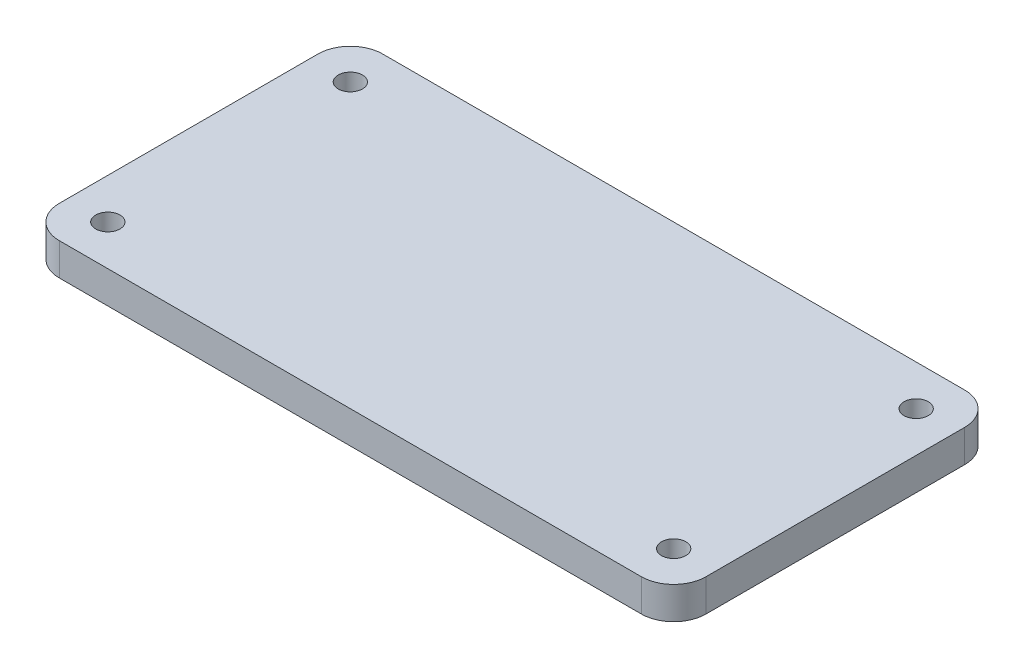
from build123d import *

# Parameters (mm, degrees)
SKETCH1_W           = 80
SKETCH1_H           = 40
SKETCH1_R           = 1.5
BOSS_EXTRUDE1_DEPTH = 4
FILLET1_R           = 4


with BuildPart() as part:
    # Sketch1 → Boss-Extrude1 (new body)
    with BuildSketch(Plane(origin=(0, 0, 0), x_dir=(1, 0, 0), z_dir=(0, 1, 0))):
        Rectangle(SKETCH1_W, SKETCH1_H)
        with Locations(Location((-35, 15, 0), (0, 0, 270))):
            Circle(SKETCH1_R, mode=Mode.SUBTRACT)
        with Locations(Location((35, 15, 0), (0, 0, 90))):
            Circle(SKETCH1_R, mode=Mode.SUBTRACT)
        with Locations(Location((35, -15, 0), (0, 0, 270))):
            Circle(SKETCH1_R, mode=Mode.SUBTRACT)
        with Locations(Location((-35, -15, 0), (0, 0, 90))):
            Circle(SKETCH1_R, mode=Mode.SUBTRACT)
    extrude(amount=BOSS_EXTRUDE1_DEPTH)

    # Fillet1
    fillet1_edges = [part.edges().sort_by_distance(p)[0] for p in [
        (-40, 2, -20),
        (40, 2, -20),
        (40, 2, 20),
        (-40, 2, 20),
    ]]
    fillet(fillet1_edges, radius=FILLET1_R)


solid = part.part
